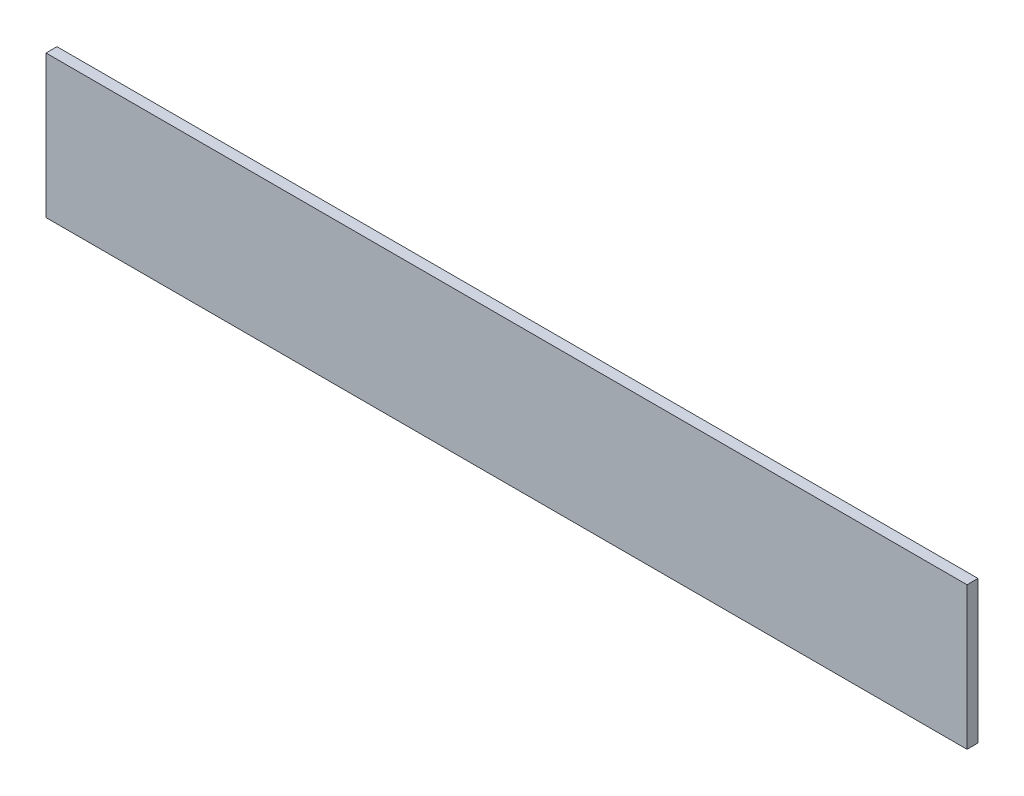
from build123d import *

# Parameters (mm, degrees)
SKETCH1_W           = 420
SKETCH1_H           = 65
BOSS_EXTRUDE1_DEPTH = 5


with BuildPart() as part:
    # Sketch1 → Boss-Extrude1 (new body)
    with BuildSketch(Plane.XY):
        with Locations((210, -32.5)):
            Rectangle(SKETCH1_W, SKETCH1_H)
    extrude(amount=BOSS_EXTRUDE1_DEPTH)


solid = part.part
